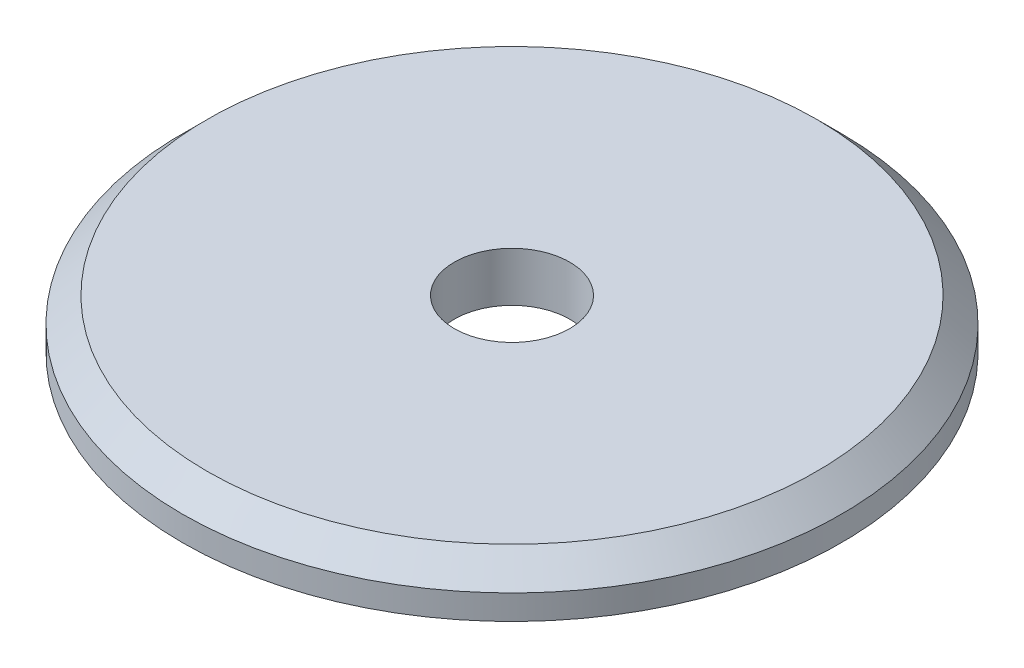
from build123d import *

# Parameters (mm, degrees)
SKETCH1_R           = 20
SKETCH1_R_2         = 3.5
BOSS_EXTRUDE1_DEPTH = 3
CHAMFER1_SIZE       = 1.5


with BuildPart() as part:
    # Sketch1 → Boss-Extrude1 (new body)
    with BuildSketch(Plane(origin=(0, 0, 0), x_dir=(1, 0, 0), z_dir=(0, 1, 0))):
        with Locations(Location((0, 0, 0), (0, 0, 270))):
            Circle(SKETCH1_R)
        with Locations(Location((0, 0, 0), (0, 0, 270))):
            Circle(SKETCH1_R_2, mode=Mode.SUBTRACT)
    extrude(amount=BOSS_EXTRUDE1_DEPTH)

    # Chamfer1
    chamfer1_edges = [part.edges().sort_by_distance(p)[0] for p in [
        (0, 3, -20),
    ]]
    chamfer(chamfer1_edges, length=CHAMFER1_SIZE)


solid = part.part
